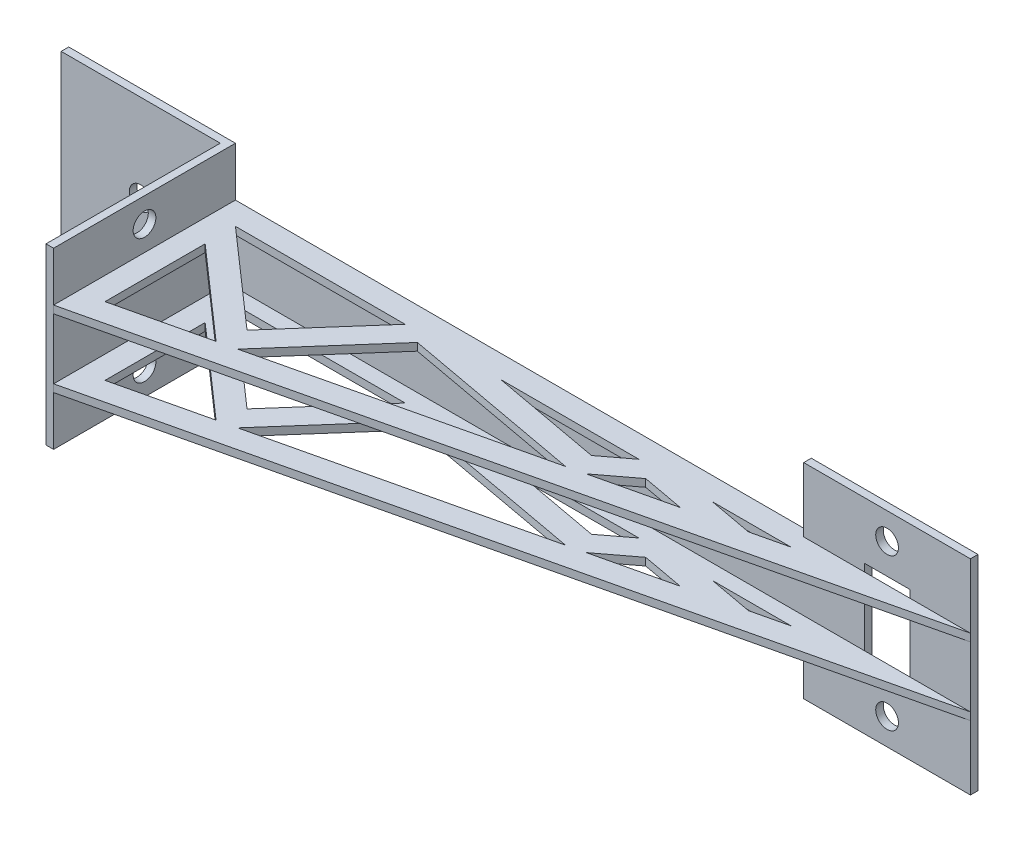
from build123d import *

# Parameters (mm, degrees)
SKETCH1_W           = 120
SKETCH1_H           = 25
BOSS_EXTRUDE4_DEPTH = 1
SKETCH6_W           = 76
SKETCH6_H           = 7.5
CUT_EXTRUDE1_DEPTH  = 62.296410988
SKETCH7_W           = 1
SKETCH7_H           = 25
BOSS_EXTRUDE5_DEPTH = 23
SKETCH11_R          = 1.5
SKETCH11_W          = 6
SKETCH11_H          = 12
CUT_EXTRUDE3_DEPTH  = 66.819829839
CUT_EXTRUDE4_DEPTH  = 1
CUT_EXTRUDE5_DEPTH  = 1
BOSS_EXTRUDE6_DEPTH = 1
SKETCH13_W          = 22
SKETCH13_H          = 1
BOSS_EXTRUDE7_DEPTH = 1
SKETCH16_R          = 1.5
CUT_EXTRUDE6_DEPTH  = 1
SKETCH17_R          = 1.5
CUT_EXTRUDE7_DEPTH  = 1
CUT_EXTRUDE8_REACH  = 69.218


with BuildPart() as part:
    # Sketch1 → Boss-Extrude4 (new body)
    with BuildSketch(Plane.XY):
        Rectangle(SKETCH1_W, SKETCH1_H)
    extrude(amount=BOSS_EXTRUDE4_DEPTH)

    # Sketch6 → Cut-Extrude1 (cut, through all)
    with BuildSketch(Plane(origin=(0, 0, 0), x_dir=(-1, 0, 0), z_dir=(0, 0, -1))):
        with Locations((0, 8.75)):
            Rectangle(SKETCH6_W, SKETCH6_H)
        with Locations((0, -8.75)):
            Rectangle(SKETCH6_W, SKETCH6_H)
    extrude(amount=-CUT_EXTRUDE1_DEPTH, mode=Mode.SUBTRACT)

    # Sketch7 → Boss-Extrude5 (add)
    with BuildSketch(Plane.XY.offset(1)):
        with Locations((-38.5, 0)):
            Rectangle(SKETCH7_W, SKETCH7_H)
    extrude(amount=BOSS_EXTRUDE5_DEPTH)

    # Sketch11 → Cut-Extrude3 (cut, through all)
    with BuildSketch(Plane(origin=(0, 0, 0), x_dir=(-1, 0, 0), z_dir=(0, 0, -1))):
        with Locations((-49, 10)):
            Circle(SKETCH11_R)
        with Locations((-49, -10)):
            Circle(SKETCH11_R)
        with Locations((-49, 0)):
            Rectangle(SKETCH11_W, SKETCH11_H)
    extrude(amount=-CUT_EXTRUDE3_DEPTH, mode=Mode.SUBTRACT)

    # Sketch14 → Cut-Extrude4 (cut)
    with BuildSketch(Plane(origin=(0, 12.5, 0), x_dir=(1, 0, 0), z_dir=(0, 1, 0))):
        Polygon((-60, -1), (-39, -1), (-39, -24), (-38, -24), (-38, 0), (-60, 0), align=None)
    extrude(amount=-CUT_EXTRUDE4_DEPTH, mode=Mode.SUBTRACT)

    # Sketch15 → Cut-Extrude5 (cut)
    with BuildSketch(Plane.XZ.offset(12.5)):
        Polygon((-60, 0), (-38, 0), (-38, 24), (-39, 24), (-39, 1), (-60, 1), align=None)
    extrude(amount=-CUT_EXTRUDE5_DEPTH, mode=Mode.SUBTRACT)

    # Sketch10 → Boss-Extrude6 (add)
    with BuildSketch(Plane(origin=(0, 5, 0), x_dir=(1, 0, 0), z_dir=(0, 1, 0))):
        Polygon((-38, -1), (-38, -24), (60, -1), align=None)
    boss_extrude6 = extrude(amount=-BOSS_EXTRUDE6_DEPTH)

    # Mirror1: Boss-Extrude6 across plane
    add(boss_extrude6.mirror(Plane(origin=(0, 0, 0), x_dir=(0, 0, 1), z_dir=(0, -1, 0))))

    # Sketch13 → Boss-Extrude7 (add)
    with BuildSketch(Plane(origin=(0, -12.5, 0), x_dir=(-1, 0, 0), z_dir=(0, -1, 0))):
        with Locations((-49, -0.5)):
            Rectangle(SKETCH13_W, SKETCH13_H)
    boss_extrude7 = extrude(amount=BOSS_EXTRUDE7_DEPTH)

    # Mirror2: Boss-Extrude7 across plane
    add(boss_extrude7.mirror(Plane(origin=(0, 0, 0), x_dir=(0, 0, 1), z_dir=(0, -1, 0))))

    # Sketch16 → Cut-Extrude6 (cut)
    with BuildSketch(Plane(origin=(-38, 0, 0), x_dir=(0, 0, -1), z_dir=(1, 0, 0))):
        with Locations(Location((-12, -8.25, 0), (0, 0, 90))):
            Circle(SKETCH16_R)
        with Locations(Location((-12, 8.25, 0), (0, 0, 90))):
            Circle(SKETCH16_R)
    extrude(amount=-CUT_EXTRUDE6_DEPTH, mode=Mode.SUBTRACT)

    # Sketch17 → Cut-Extrude7 (cut)
    with BuildSketch(Plane.XY.offset(1)):
        with Locations((-49.5, 0)):
            Circle(SKETCH17_R)
    extrude(amount=-CUT_EXTRUDE7_DEPTH, mode=Mode.SUBTRACT)

    # Cut-Extrude8: up to this face of the body (flat: up to its plane)
    cut_extrude8_end = Plane(part.part.faces().sort_by_distance((-4.996397894, -5, 8.150734275))[0])
    # Sketch18 → Cut-Extrude8 (cut, up to the picked face)
    with BuildSketch(Plane(origin=(0, 5, 0), x_dir=(1, 0, 0), z_dir=(0, 1, 0)), mode=Mode.PRIVATE) as cut_extrude8_sk1:
        Polygon((-35, -6.994072078), (-35, -20.214403976), (-23.128514946, -17.428239116), align=None)
    cut_extrude8_tool1 = split(extrude(cut_extrude8_sk1.sketch, amount=-CUT_EXTRUDE8_REACH, mode=Mode.PRIVATE), bisect_by=cut_extrude8_end, keep=Keep.BOTH, mode=Mode.PRIVATE)
    # Sketch18 → Cut-Extrude8 (cut, up to the picked face)
    with BuildSketch(Plane(origin=(0, 5, 0), x_dir=(1, 0, 0), z_dir=(0, 1, 0)), mode=Mode.PRIVATE) as cut_extrude8_sk2:
        Polygon((38.348329984, -3), (27.953371723, -3), (33.784828112, -4.071025949), align=None)
    cut_extrude8_tool2 = split(extrude(cut_extrude8_sk2.sketch, amount=-CUT_EXTRUDE8_REACH, mode=Mode.PRIVATE), bisect_by=cut_extrude8_end, keep=Keep.BOTH, mode=Mode.PRIVATE)
    # Sketch18 → Cut-Extrude8 (cut, up to the picked face)
    with BuildSketch(Plane(origin=(0, 5, 0), x_dir=(1, 0, 0), z_dir=(0, 1, 0)), mode=Mode.PRIVATE) as cut_extrude8_sk3:
        Polygon((-35, -3), (-22.366422742, -14.103990342), (-12.606827419, -3), align=None)
    cut_extrude8_tool3 = split(extrude(cut_extrude8_sk3.sketch, amount=-CUT_EXTRUDE8_REACH, mode=Mode.PRIVATE), bisect_by=cut_extrude8_end, keep=Keep.BOTH, mode=Mode.PRIVATE)
    # Sketch18 → Cut-Extrude8 (cut, up to the picked face)
    with BuildSketch(Plane(origin=(0, 5, 0), x_dir=(1, 0, 0), z_dir=(0, 1, 0)), mode=Mode.PRIVATE) as cut_extrude8_sk4:
        Polygon((-20.817385235, -16.885831123), (-9.723935411, -4.264246351), (14.222143926, -8.662268156), align=None)
    cut_extrude8_tool4 = split(extrude(cut_extrude8_sk4.sketch, amount=-CUT_EXTRUDE8_REACH, mode=Mode.PRIVATE), bisect_by=cut_extrude8_end, keep=Keep.BOTH, mode=Mode.PRIVATE)
    # Sketch18 → Cut-Extrude8 (cut, up to the picked face)
    with BuildSketch(Plane(origin=(0, 5, 0), x_dir=(1, 0, 0), z_dir=(0, 1, 0)), mode=Mode.PRIVATE) as cut_extrude8_sk5:
        Polygon((14.690257392, -5.69806474), (18.253543406, -3), (0, -3), align=None)
    cut_extrude8_tool5 = split(extrude(cut_extrude8_sk5.sketch, amount=-CUT_EXTRUDE8_REACH, mode=Mode.PRIVATE), bisect_by=cut_extrude8_end, keep=Keep.BOTH, mode=Mode.PRIVATE)
    # Sketch18 → Cut-Extrude8 (cut, up to the picked face)
    with BuildSketch(Plane(origin=(0, 5, 0), x_dir=(1, 0, 0), z_dir=(0, 1, 0)), mode=Mode.PRIVATE) as cut_extrude8_sk6:
        Polygon((20.904659834, -4.755587386), (26.493983886, -5.782142452), (16.429296354, -8.144262995), align=None)
    cut_extrude8_tool6 = split(extrude(cut_extrude8_sk6.sketch, amount=-CUT_EXTRUDE8_REACH, mode=Mode.PRIVATE), bisect_by=cut_extrude8_end, keep=Keep.BOTH, mode=Mode.PRIVATE)
    add(cut_extrude8_tool1.solids().sort_by(Axis((-31.042838, 5, 14.878905), (0, -1, 0)))[0], mode=Mode.SUBTRACT)
    add(cut_extrude8_tool2.solids().sort_by(Axis((33.362177, 5, 3.357009), (0, -1, 0)))[0], mode=Mode.SUBTRACT)
    add(cut_extrude8_tool3.solids().sort_by(Axis((-23.324417, 5, 6.70133), (0, -1, 0)))[0], mode=Mode.SUBTRACT)
    add(cut_extrude8_tool4.solids().sort_by(Axis((-5.439726, 5, 9.937449), (0, -1, 0)))[0], mode=Mode.SUBTRACT)
    add(cut_extrude8_tool5.solids().sort_by(Axis((10.981267, 5, 3.899355), (0, -1, 0)))[0], mode=Mode.SUBTRACT)
    add(cut_extrude8_tool6.solids().sort_by(Axis((21.27598, 5, 6.227331), (0, -1, 0)))[0], mode=Mode.SUBTRACT)


solid = part.part
